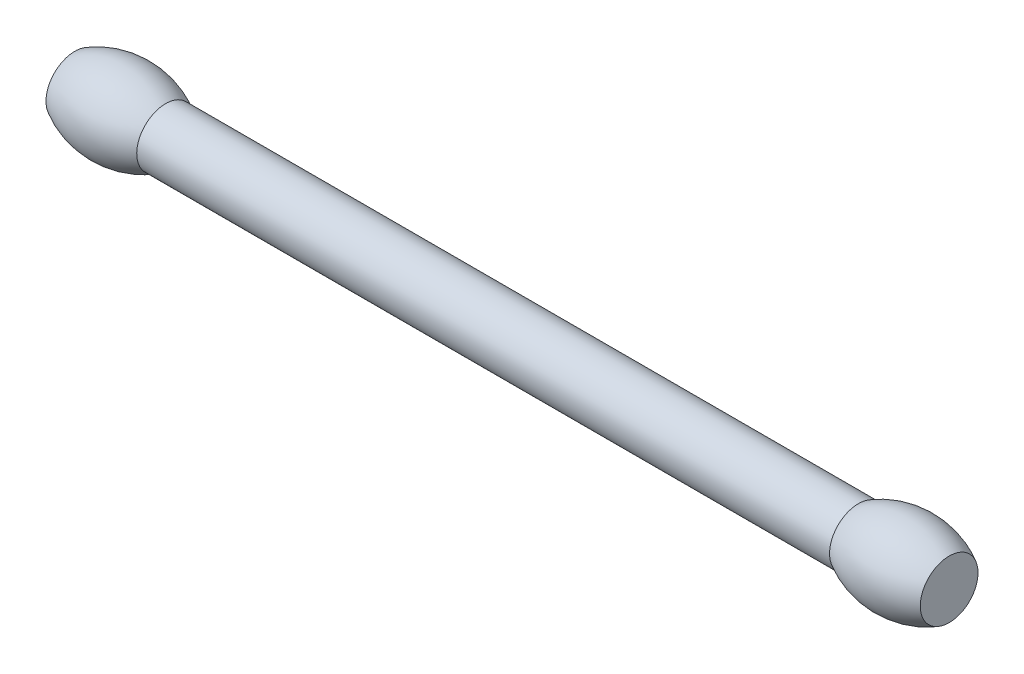
from build123d import *


with BuildPart() as part:
    # Sketch1 → Revolve1 (revolve)
    with BuildSketch(Plane.XY, mode=Mode.PRIVATE) as revolve1_sk:
        with BuildLine():
            ThreePointArc((54.29249997, 5.6515), (51.042658326, 5.231868239), (48.006, 4.0005))
            Line((48.006, 4.0005), (-48.006, 4.0005))
            ThreePointArc((-48.006, 4.0005), (-51.042658379, 5.231868252), (-54.292500079, 5.6515))
            ThreePointArc((-54.292500079, 5.6515), (-57.542341698, 5.231868232), (-60.579, 4.0005))
            Line((-60.579, 4.0005), (-60.579, 0))
            Line((-60.579, 0), (48.006, 0))
            Line((48.006, 0), (60.579, 0))
            Line((60.579, 0), (60.579, 4.0005))
            ThreePointArc((60.579, 4.0005), (57.542341645, 5.231868246), (54.29249997, 5.6515))
        make_face()
    revolve(revolve1_sk.sketch.rotate(Axis((66.409028462, 0, 0), (1, 0, 0)), 180), axis=Axis((66.409028462, 0, 0), (1, 0, 0)))


solid = part.part
